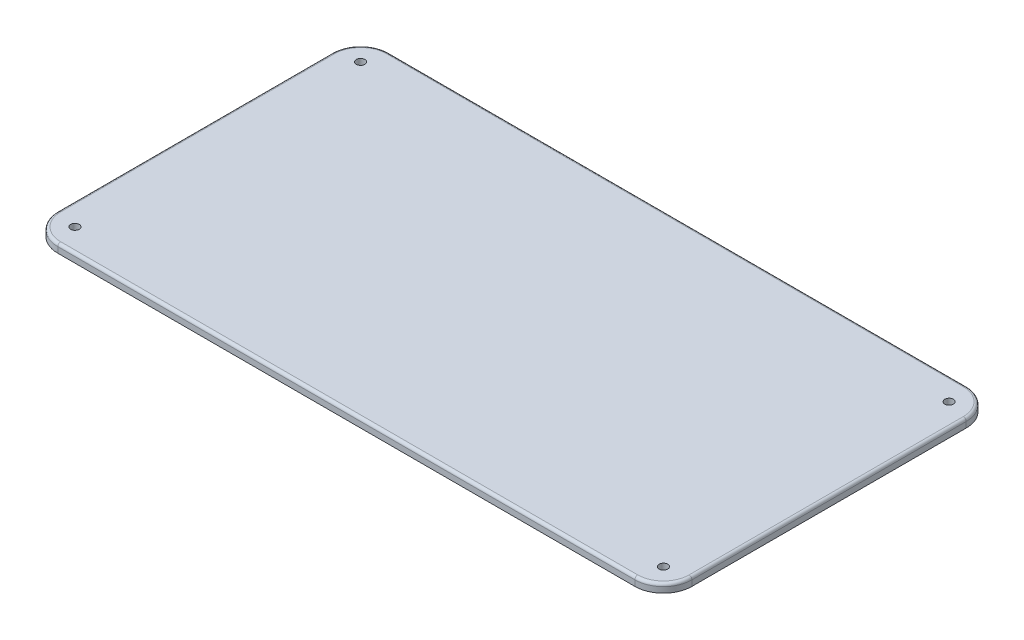
from build123d import *

# Parameters (mm, degrees)
SKETCH1_R           = 1.5
BOSS_EXTRUDE1_DEPTH = 3
FILLET1_R           = 1


with BuildPart() as part:
    # Sketch1 → Boss-Extrude1 (new body)
    with BuildSketch(Plane(origin=(0, 57, 0), x_dir=(1, 0, 0), z_dir=(0, 1, 0))):
        with BuildLine():
            Line((-31.5, -17), (-26.5, -17))
            Line((-26.5, -17), (7, -17))
            ThreePointArc((7, -17), (14.071067812, -14.071067812), (17, -7))
            Line((17, -7), (17, 89))
            ThreePointArc((17, 89), (14.071067812, 96.071067812), (7, 99))
            Line((7, 99), (-195, 99))
            ThreePointArc((-195, 99), (-202.071067812, 96.071067812), (-205, 89))
            Line((-205, 89), (-205, -7))
            ThreePointArc((-205, -7), (-202.071067812, -14.071067812), (-195, -17))
            Line((-195, -17), (-31.5, -17))
        make_face()
        with Locations(Location((-197, 91, 0), (0, 0, 270))):
            Circle(SKETCH1_R, mode=Mode.SUBTRACT)
        with Locations(Location((9, 91, 0), (0, 0, 270))):
            Circle(SKETCH1_R, mode=Mode.SUBTRACT)
        with Locations(Location((9, -9, 0), (0, 0, 270))):
            Circle(SKETCH1_R, mode=Mode.SUBTRACT)
        with Locations(Location((-197, -9, 0), (0, 0, 270))):
            Circle(SKETCH1_R, mode=Mode.SUBTRACT)
    extrude(amount=BOSS_EXTRUDE1_DEPTH)

    # Fillet1
    fillet1_edges = [part.edges().sort_by_distance(p)[0] for p in [
        (17, 60, -41),
        (14.071067812, 60, -96.071067812),
        (-94, 60, -99),
        (-202.071067812, 60, -96.071067812),
        (-205, 60, -41),
        (-202.071067812, 60, 14.071067812),
        (-94, 60, 17),
        (14.071067812, 60, 14.071067812),
    ]]
    fillet(fillet1_edges, radius=FILLET1_R)


solid = part.part
